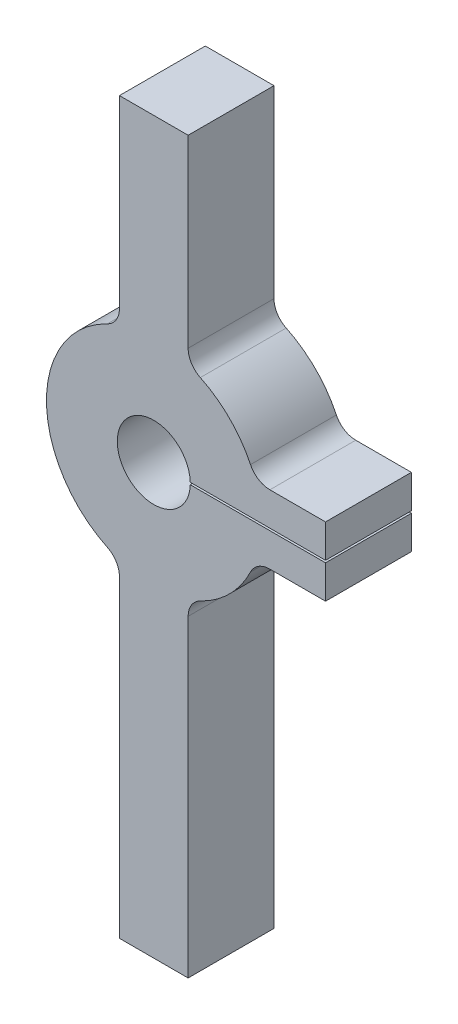
from build123d import *

# Parameters (mm, degrees)
SKETCH1_R               = 25
SKETCH1_R_2             = 8.5
BOSS_EXTRUDE1_DEPTH     = 10
SKETCH2_W               = 16
SKETCH2_H               = 46.314561435
BOSS_EXTRUDE2_DEPTH     = 10
SKETCH3_W               = 16
SKETCH3_H               = 76.314561435
BOSS_EXTRUDE3_DEPTH     = 10
SKETCH4_W               = 16.314561435
SKETCH4_H               = 16
BOSS_EXTRUDE4_DEPTH     = 10
CUT_EXTRUDE1_DEPTH      = 109.166538264
CUT_EXTRUDE1_DEPTH_BACK = 109.166538264
SKETCH5_W               = 48
SKETCH5_H               = 0.5
FILLET1_R               = 5
SKETCH7_W               = 3
SKETCH7_H               = 5.5


with BuildPart() as part:
    # Sketch1 → Boss-Extrude1 (new, symmetric)
    with BuildSketch(Plane.XY):
        Circle(SKETCH1_R)
        Circle(SKETCH1_R_2, mode=Mode.SUBTRACT)
    extrude(amount=BOSS_EXTRUDE1_DEPTH, both=True)

    # Sketch2 → Boss-Extrude2 (add, symmetric)
    with BuildSketch(Plane.XY):
        with Locations((0, 46.842719282)):
            Rectangle(SKETCH2_W, SKETCH2_H)
    extrude(amount=BOSS_EXTRUDE2_DEPTH, both=True)

    # Sketch3 → Boss-Extrude3 (add, symmetric)
    with BuildSketch(Plane.XY):
        with Locations((0, -61.842719282)):
            Rectangle(SKETCH3_W, SKETCH3_H)
    extrude(amount=BOSS_EXTRUDE3_DEPTH, both=True)

    # Sketch4 → Boss-Extrude4 (add, symmetric)
    with BuildSketch(Plane.XY):
        with Locations((31.842719282, 0)):
            Rectangle(SKETCH4_W, SKETCH4_H)
    extrude(amount=BOSS_EXTRUDE4_DEPTH, both=True)

    # Sketch5 → Cut-Extrude1 (cut, two sides: drawn at the far end of the back side and taken through both)
    with BuildSketch(Plane.XY.offset(-CUT_EXTRUDE1_DEPTH_BACK)):
        with Locations((26, 0)):
            Rectangle(SKETCH5_W, SKETCH5_H)
    extrude(amount=CUT_EXTRUDE1_DEPTH + CUT_EXTRUDE1_DEPTH_BACK, mode=Mode.SUBTRACT)

    # Fillet1
    fillet1_edges = [part.edges().sort_by_distance(p)[0] for p in [
        (8, 23.685438565, 0),
        (-8, 23.685438565, 0),
        (8, -23.685438565, 0),
        (-8, -23.685438565, 0),
        (23.685438565, -8, 0),
        (23.685438565, 8, 0),
    ]]
    fillet(fillet1_edges, radius=FILLET1_R)

    # Sketch7 → Cut-Revolve1 (revolve, cut)
    with BuildSketch(Plane(origin=(0, 0, 0), x_dir=(0, 0, -1), z_dir=(1, 0, 0))):
        with Locations((8.5, 11.25)):
            Rectangle(SKETCH7_W, SKETCH7_H)
    revolve(axis=Axis((0, 0, 0), (0, 0, -1)), mode=Mode.SUBTRACT)


solid = part.part
